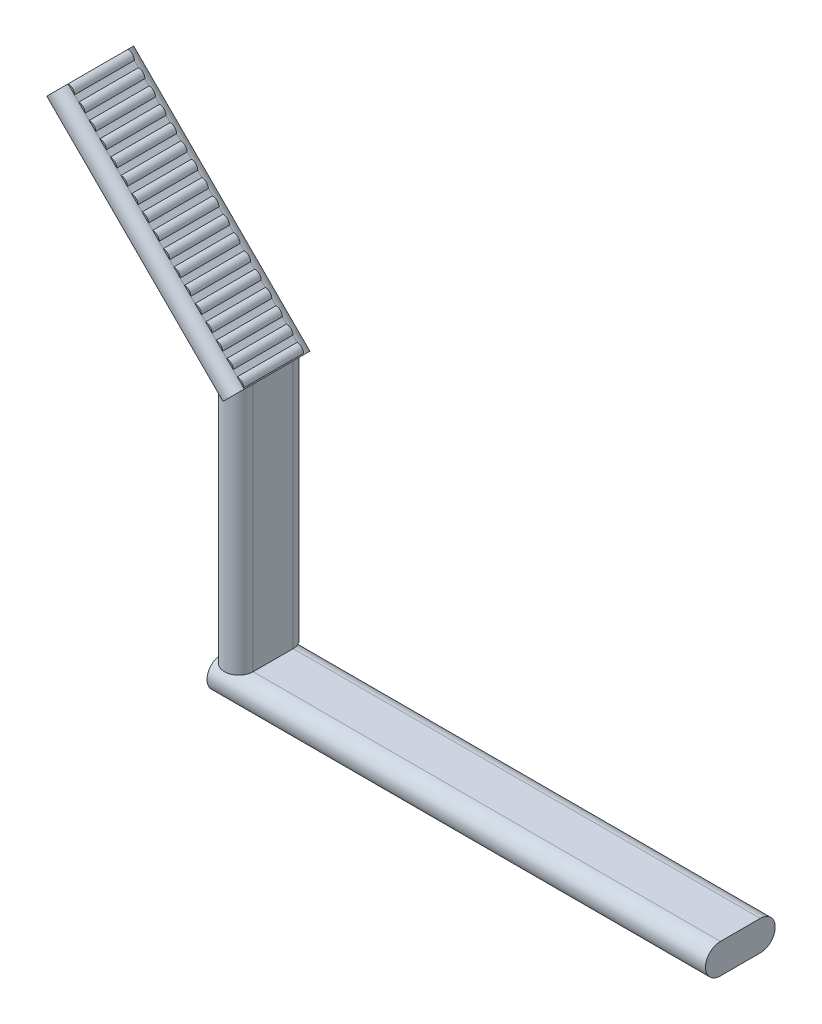
from build123d import *

# Parameters (mm, degrees)
BOSS_EXTRUDE1_DEPTH = 250
BOSS_EXTRUDE6_DEPTH = 125
BOSS_EXTRUDE7_DEPTH = 125
BOSS_EXTRUDE8_DEPTH = 30


with BuildPart() as part:
    # Sketch1 → Boss-Extrude1 (new body)
    with BuildSketch(Plane(origin=(0, 0, 0), x_dir=(0, 0, -1), z_dir=(1, 0, 0))):
        with BuildLine():
            Line((-10, 7.5), (10, 7.5))
            ThreePointArc((10, 7.5), (17.5, 0), (10, -7.5))
            Line((10, -7.5), (-10, -7.5))
            ThreePointArc((-10, -7.5), (-17.5, 0), (-10, 7.5))
        make_face()
    extrude(amount=BOSS_EXTRUDE1_DEPTH)

    # Sketch11 → Boss-Extrude6 (add)
    with BuildSketch(Plane(origin=(0, 7.5, 0), x_dir=(1, 0, 0), z_dir=(0, 1, 0))):
        with BuildLine():
            Line((1.220843579, -10), (1.220843579, 10))
            ThreePointArc((1.220843579, 10), (8.447072594, 17.226229015), (15.673301609, 10))
            Line((15.673301609, 10), (15.673301609, -10))
            ThreePointArc((15.673301609, -10), (8.447072594, -17.226229015), (1.220843579, -10))
        make_face()
    extrude(amount=BOSS_EXTRUDE6_DEPTH)

    # Sketch12 → Boss-Extrude7 (add)
    with BuildSketch(Plane(origin=(-58.413349195, 58.413349195, 0), x_dir=(-0.7071067811865476, -0.7071067811865476, 0), z_dir=(0.7071067811865476, -0.7071067811865476, 0))):
        with BuildLine():
            Line((-105.56811993, -15), (-105.56811993, 15))
            ThreePointArc((-105.56811993, 15), (-100.022563681, 20.545556249), (-94.477007433, 15))
            Line((-94.477007433, 15), (-94.477007433, -15))
            ThreePointArc((-94.477007433, -15), (-100.022563681, -20.545556249), (-105.56811993, -15))
        make_face()
    extrude(amount=-BOSS_EXTRUDE7_DEPTH)

    # Sketch13 → Boss-Extrude8 (add)
    with BuildSketch(Plane(origin=(0, 0, 15), x_dir=(0.7071067811865476, -0.7071067811865476, 0), z_dir=(0, 0, 1))):
        with BuildLine():
            Line((-207.608950656, 105.56811993), (-203.079358094, 105.56811993))
            ThreePointArc((-203.079358094, 105.56811993), (-205.344154375, 106.506229266), (-207.608950656, 105.56811993))
        make_face()
        with BuildLine():
            Line((-200.108950656, 105.56811993), (-195.579358094, 105.56811993))
            ThreePointArc((-195.579358094, 105.56811993), (-197.844154375, 106.506229266), (-200.108950656, 105.56811993))
        make_face()
        with BuildLine():
            Line((-192.608950656, 105.56811993), (-188.079358094, 105.56811993))
            ThreePointArc((-188.079358094, 105.56811993), (-190.344154375, 106.506229266), (-192.608950656, 105.56811993))
        make_face()
        with BuildLine():
            Line((-185.108950656, 105.56811993), (-180.579358094, 105.56811993))
            ThreePointArc((-180.579358094, 105.56811993), (-182.844154375, 106.506229266), (-185.108950656, 105.56811993))
        make_face()
        with BuildLine():
            Line((-177.608950656, 105.56811993), (-173.079358094, 105.56811993))
            ThreePointArc((-173.079358094, 105.56811993), (-175.344154375, 106.506229266), (-177.608950656, 105.56811993))
        make_face()
        with BuildLine():
            Line((-170.108950656, 105.56811993), (-165.579358094, 105.56811993))
            ThreePointArc((-165.579358094, 105.56811993), (-167.844154375, 106.506229266), (-170.108950656, 105.56811993))
        make_face()
        with BuildLine():
            Line((-162.608950656, 105.56811993), (-158.079358094, 105.56811993))
            ThreePointArc((-158.079358094, 105.56811993), (-160.344154375, 106.506229266), (-162.608950656, 105.56811993))
        make_face()
        with BuildLine():
            Line((-155.108950656, 105.56811993), (-150.579358094, 105.56811993))
            ThreePointArc((-150.579358094, 105.56811993), (-152.844154375, 106.506229266), (-155.108950656, 105.56811993))
        make_face()
        with BuildLine():
            Line((-147.608950656, 105.56811993), (-143.079358094, 105.56811993))
            ThreePointArc((-143.079358094, 105.56811993), (-145.344154375, 106.506229266), (-147.608950656, 105.56811993))
        make_face()
        with BuildLine():
            Line((-140.108950656, 105.56811993), (-135.579358094, 105.56811993))
            ThreePointArc((-135.579358094, 105.56811993), (-137.844154375, 106.506229266), (-140.108950656, 105.56811993))
        make_face()
        with BuildLine():
            Line((-132.608950656, 105.56811993), (-128.079358094, 105.56811993))
            ThreePointArc((-128.079358094, 105.56811993), (-130.344154375, 106.506229266), (-132.608950656, 105.56811993))
        make_face()
        with BuildLine():
            Line((-125.108950656, 105.56811993), (-120.579358094, 105.56811993))
            ThreePointArc((-120.579358094, 105.56811993), (-122.844154375, 106.506229266), (-125.108950656, 105.56811993))
        make_face()
        with BuildLine():
            Line((-117.608950656, 105.56811993), (-113.079358094, 105.56811993))
            ThreePointArc((-113.079358094, 105.56811993), (-115.344154375, 106.506229266), (-117.608950656, 105.56811993))
        make_face()
        with BuildLine():
            Line((-110.108950656, 105.56811993), (-105.579358094, 105.56811993))
            ThreePointArc((-105.579358094, 105.56811993), (-107.844154375, 106.506229266), (-110.108950656, 105.56811993))
        make_face()
        with BuildLine():
            Line((-102.608950656, 105.56811993), (-98.079358094, 105.56811993))
            ThreePointArc((-98.079358094, 105.56811993), (-100.344154375, 106.506229266), (-102.608950656, 105.56811993))
        make_face()
        with BuildLine():
            Line((-95.108950656, 105.56811993), (-90.579358094, 105.56811993))
            ThreePointArc((-90.579358094, 105.56811993), (-92.844154375, 106.506229266), (-95.108950656, 105.56811993))
        make_face()
        with BuildLine():
            Line((-87.608950656, 105.56811993), (-83.079358094, 105.56811993))
            ThreePointArc((-83.079358094, 105.56811993), (-85.344154375, 106.506229266), (-87.608950656, 105.56811993))
        make_face()
    extrude(amount=-BOSS_EXTRUDE8_DEPTH)


solid = part.part
